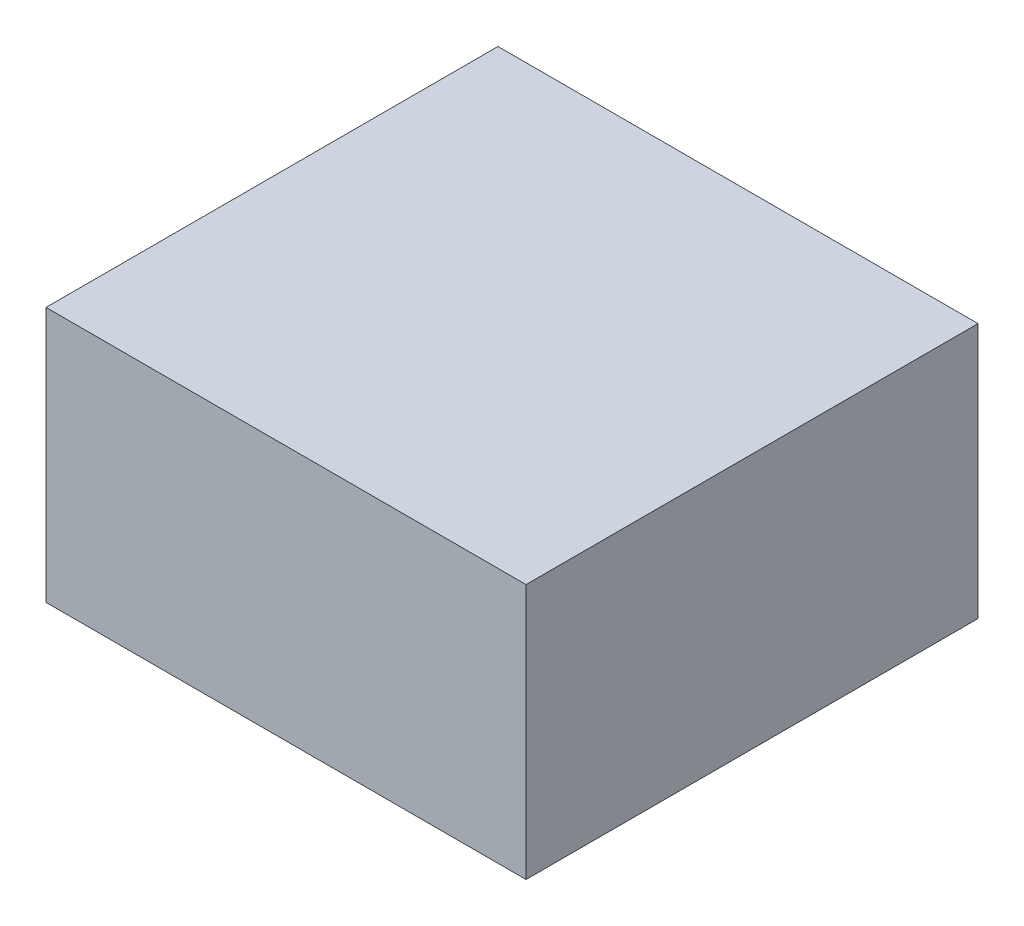
from build123d import *

# Parameters (mm, degrees)
SKETCH_1_W      = 171
SKETCH_1_H      = 161
EXTRUDE_1_DEPTH = 91


with BuildPart() as part:
    # Эскиз1 → Бобышка-Вытянуть1 (new body)
    with BuildSketch(Plane(origin=(0, 0, 0), x_dir=(1, 0, 0), z_dir=(0, 1, 0))):
        with Locations((85.5, -80.5)):
            Rectangle(SKETCH_1_W, SKETCH_1_H)
    extrude(amount=EXTRUDE_1_DEPTH)


solid = part.part
